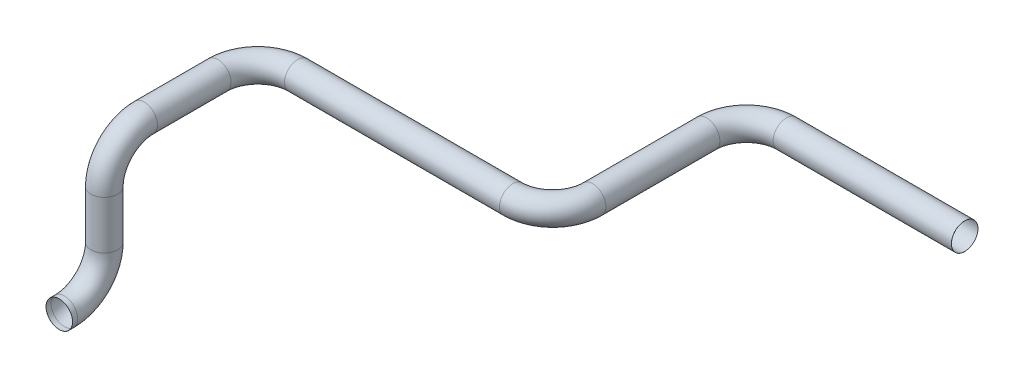
from build123d import *

# Parameters (mm, degrees)
BARRER2_PROFILE_R = 5
VACIADO2_T        = -0.01


with BuildPart() as part:
    # Barrer2: sweep along a curve in space
    with BuildLine() as barrer2_path:
        Line((0, 0, 0), (0, 0, -1.914207024))
        ThreePointArc((0, 0, -1.914207024), (0, 4.393398282, -12.520808742), (0, 15, -16.914207024))
        Line((0, 15, -16.914207024), (0, 33.105439797, -16.914207024))
        ThreePointArc((0, 33.105439797, -16.914207024), (0, 43.712041515, -21.307605307), (0, 48.105439797, -31.914207024))
        Line((0, 48.105439797, -31.914207024), (0, 48.105439797, -59.601002877))
        ThreePointArc((0, 48.105439797, -59.601002877), (4.393398282, 48.105439797, -70.207604595), (15, 48.105439797, -74.601002877))
        Line((15, 48.105439797, -74.601002877), (95.823303113, 48.105439797, -74.601002877))
        ThreePointArc((95.823303113, 48.105439797, -74.601002877), (106.42990483, 48.105439797, -78.994401159), (110.823303113, 48.105439797, -89.601002877))
        Line((110.823303113, 48.105439797, -89.601002877), (110.823303113, 48.105439797, -132.422083172))
        ThreePointArc((110.823303113, 48.105439797, -132.422083172), (115.216701395, 48.105439797, -143.028684889), (125.823303113, 48.105439797, -147.422083172))
        Line((125.823303113, 48.105439797, -147.422083172), (192.816056145, 48.105439797, -147.422083172))
    # Barrer2 profile (on start of the path) → Barrer2 (sweep)
    with BuildSketch(Plane(origin=(0, 0, 0), x_dir=(-1, 0, 0), z_dir=(0, 0, -1))):
        Circle(BARRER2_PROFILE_R)
    sweep(path=barrer2_path.line)

    # Vaciado2
    vaciado2_openings = [part.faces().sort_by_distance(p)[0] for p in [
        (0, 0, 0),
        (192.816056145, 48.105439797, -147.422083172),
    ]]
    offset(amount=VACIADO2_T, openings=vaciado2_openings, kind=Kind.INTERSECTION)


solid = part.part
